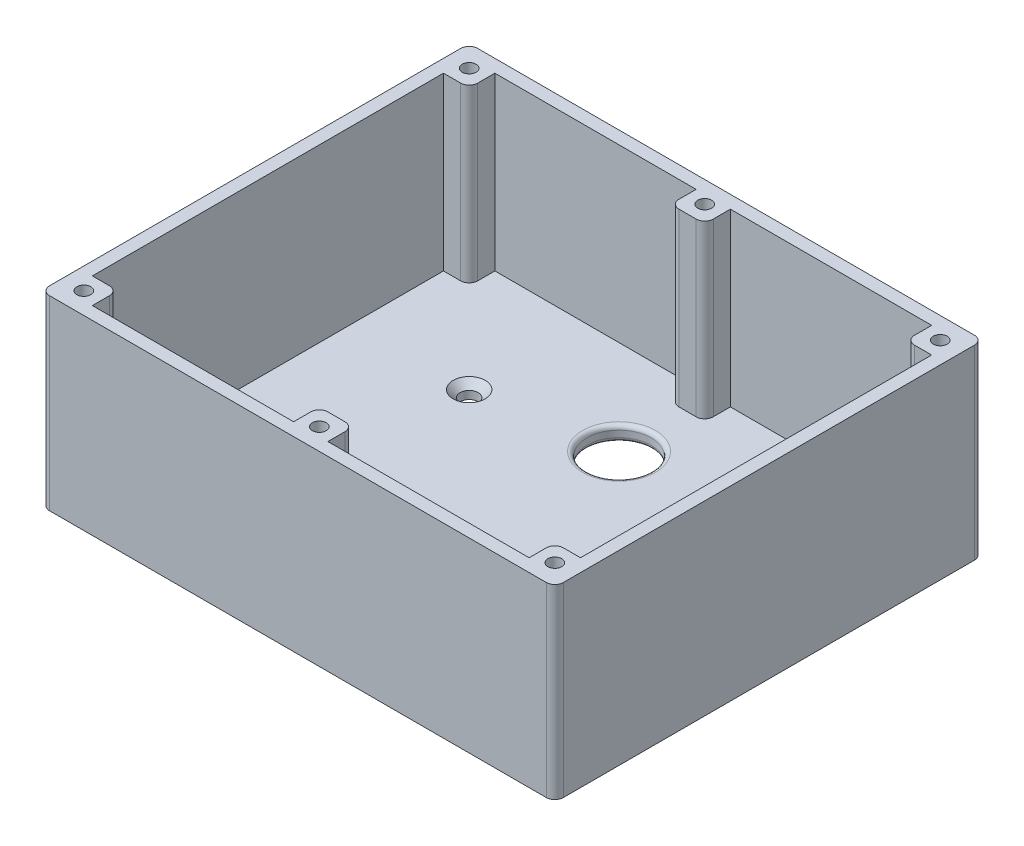
from build123d import *

# Parameters (mm, degrees)
SKETCH1_W                             = 120
SKETCH1_H                             = 100
BOTTOM_DEPTH                          = 3.5
SKETCH3_W                             = 120
SKETCH3_H                             = 100
WALL_DEPTH                            = 40
SKETCH4_R                             = 1.625
TOP_PLATE_SCREW_HOLES_DEPTH           = 30
TOP_PLATE_SCREW_HOLES_DRAFT           = -1
TOP_PLATE_SCREW_HOLES_PROFILE_2_DEPTH = 30
TOP_PLATE_SCREW_HOLES_PROFILE_2_DRAFT = -1
TOP_PLATE_SCREW_HOLES_PROFILE_3_DEPTH = 30
TOP_PLATE_SCREW_HOLES_PROFILE_3_DRAFT = -1
TOP_PLATE_SCREW_HOLES_PROFILE_4_DEPTH = 30
TOP_PLATE_SCREW_HOLES_PROFILE_4_DRAFT = -1
TOP_PLATE_SCREW_HOLES_PROFILE_5_DEPTH = 30
TOP_PLATE_SCREW_HOLES_PROFILE_5_DRAFT = -1
TOP_PLATE_SCREW_HOLES_PROFILE_6_DEPTH = 30
TOP_PLATE_SCREW_HOLES_PROFILE_6_DRAFT = -1
FILLET14_R                            = 2
FILLET13_R                            = 2
FILLET12_R                            = 2
FILLET11_R                            = 2
FILLET1_R                             = 2
FILLET2_R                             = 2
FILLET3_R                             = 2
FILLET4_R                             = 2
FILLET5_R                             = 2
FILLET6_R                             = 2
FILLET7_R                             = 2
FILLET8_R                             = 2
M4_MOUNT_R                            = 2.1
M4_MOUNT_CUT_DEPTH                    = 88.749643874
SKETCH7_R                             = 7.5
USB_CABEL_CUT_DEPTH                   = 90.399384785
FILLET9_R                             = 1
FILLET10_R                            = 1


with BuildPart() as part:
    # Sketch1 → Bottom (new body)
    with BuildSketch(Plane(origin=(0, 0, 0), x_dir=(1, 0, 0), z_dir=(0, 1, 0))):
        Rectangle(SKETCH1_W, SKETCH1_H)
    extrude(amount=BOTTOM_DEPTH)

    # Sketch3 → Wall (add)
    with BuildSketch(Plane(origin=(0, 3.5, 0), x_dir=(1, 0, 0), z_dir=(0, 1, 0))):
        Rectangle(SKETCH3_W, SKETCH3_H)
        Polygon((-51, 47), (-4, 47), (-4, 41), (4, 41), (4, 47), (51, 47), (51, 41), (57, 41), (57, -41), (51, -41), (51, -47), (4, -47), (4, -41), (-4, -41), (-4, -47), (-51, -47), (-51, -41), (-57, -41), (-57, 41), (-51, 41), align=None, mode=Mode.SUBTRACT)
    extrude(amount=WALL_DEPTH)


with BuildPart() as top_plate_screw_holes_tool:
    # Sketch4 → Top Plate Screw Holes (with draft: the straight prism first)
    with BuildSketch(Plane(origin=(0, 43.5, 0), x_dir=(1, 0, 0), z_dir=(0, 1, 0))):
        with Locations((-55, 45)):
            Circle(SKETCH4_R)
    extrude(amount=-TOP_PLATE_SCREW_HOLES_DEPTH)
    # Top Plate Screw Holes: the draft: its side faces are tilted about the plane it starts from
    top_plate_screw_holes_sides = [top_plate_screw_holes_tool.faces().sort_by_distance(p)[0] for p in [
        (-56.625, 28.5, -45),
    ]]
    draft(top_plate_screw_holes_sides, Plane(origin=(0, 43.5, 0), x_dir=(1, 0, 0), z_dir=(0, 1, 0)), TOP_PLATE_SCREW_HOLES_DRAFT)


with BuildPart() as part_1:
    add(part.part)

    # Top Plate Screw Holes: cut by top_plate_screw_holes_tool
    add(top_plate_screw_holes_tool.part, mode=Mode.SUBTRACT)


with BuildPart() as top_plate_screw_holes_profile_2_tool:
    # Sketch4 → Top Plate Screw Holes profile 2 (with draft: the straight prism first)
    with BuildSketch(Plane(origin=(0, 43.5, 0), x_dir=(1, 0, 0), z_dir=(0, 1, 0))):
        with Locations((55, 45)):
            Circle(SKETCH4_R)
    extrude(amount=-TOP_PLATE_SCREW_HOLES_PROFILE_2_DEPTH)
    # Top Plate Screw Holes profile 2: the draft: its side faces are tilted about the plane it starts from
    top_plate_screw_holes_profile_2_sides = [top_plate_screw_holes_profile_2_tool.faces().sort_by_distance(p)[0] for p in [
        (53.375, 28.5, -45),
    ]]
    draft(top_plate_screw_holes_profile_2_sides, Plane(origin=(0, 43.5, 0), x_dir=(1, 0, 0), z_dir=(0, 1, 0)), TOP_PLATE_SCREW_HOLES_PROFILE_2_DRAFT)


with BuildPart() as part_2:
    add(part_1.part)

    # Top Plate Screw Holes profile 2: cut by top_plate_screw_holes_profile_2_tool
    add(top_plate_screw_holes_profile_2_tool.part, mode=Mode.SUBTRACT)


with BuildPart() as top_plate_screw_holes_profile_3_tool:
    # Sketch4 → Top Plate Screw Holes profile 3 (with draft: the straight prism first)
    with BuildSketch(Plane(origin=(0, 43.5, 0), x_dir=(1, 0, 0), z_dir=(0, 1, 0))):
        with Locations((55, -45)):
            Circle(SKETCH4_R)
    extrude(amount=-TOP_PLATE_SCREW_HOLES_PROFILE_3_DEPTH)
    # Top Plate Screw Holes profile 3: the draft: its side faces are tilted about the plane it starts from
    top_plate_screw_holes_profile_3_sides = [top_plate_screw_holes_profile_3_tool.faces().sort_by_distance(p)[0] for p in [
        (53.375, 28.5, 45),
    ]]
    draft(top_plate_screw_holes_profile_3_sides, Plane(origin=(0, 43.5, 0), x_dir=(1, 0, 0), z_dir=(0, 1, 0)), TOP_PLATE_SCREW_HOLES_PROFILE_3_DRAFT)


with BuildPart() as part_3:
    add(part_2.part)

    # Top Plate Screw Holes profile 3: cut by top_plate_screw_holes_profile_3_tool
    add(top_plate_screw_holes_profile_3_tool.part, mode=Mode.SUBTRACT)


with BuildPart() as top_plate_screw_holes_profile_4_tool:
    # Sketch4 → Top Plate Screw Holes profile 4 (with draft: the straight prism first)
    with BuildSketch(Plane(origin=(0, 43.5, 0), x_dir=(1, 0, 0), z_dir=(0, 1, 0))):
        with Locations((-55, -45)):
            Circle(SKETCH4_R)
    extrude(amount=-TOP_PLATE_SCREW_HOLES_PROFILE_4_DEPTH)
    # Top Plate Screw Holes profile 4: the draft: its side faces are tilted about the plane it starts from
    top_plate_screw_holes_profile_4_sides = [top_plate_screw_holes_profile_4_tool.faces().sort_by_distance(p)[0] for p in [
        (-56.625, 28.5, 45),
    ]]
    draft(top_plate_screw_holes_profile_4_sides, Plane(origin=(0, 43.5, 0), x_dir=(1, 0, 0), z_dir=(0, 1, 0)), TOP_PLATE_SCREW_HOLES_PROFILE_4_DRAFT)


with BuildPart() as part_4:
    add(part_3.part)

    # Top Plate Screw Holes profile 4: cut by top_plate_screw_holes_profile_4_tool
    add(top_plate_screw_holes_profile_4_tool.part, mode=Mode.SUBTRACT)


with BuildPart() as top_plate_screw_holes_profile_5_tool:
    # Sketch4 → Top Plate Screw Holes profile 5 (with draft: the straight prism first)
    with BuildSketch(Plane(origin=(0, 43.5, 0), x_dir=(1, 0, 0), z_dir=(0, 1, 0))):
        with Locations((0, 45)):
            Circle(SKETCH4_R)
    extrude(amount=-TOP_PLATE_SCREW_HOLES_PROFILE_5_DEPTH)
    # Top Plate Screw Holes profile 5: the draft: its side faces are tilted about the plane it starts from
    top_plate_screw_holes_profile_5_sides = [top_plate_screw_holes_profile_5_tool.faces().sort_by_distance(p)[0] for p in [
        (-1.625, 28.5, -45),
    ]]
    draft(top_plate_screw_holes_profile_5_sides, Plane(origin=(0, 43.5, 0), x_dir=(1, 0, 0), z_dir=(0, 1, 0)), TOP_PLATE_SCREW_HOLES_PROFILE_5_DRAFT)


with BuildPart() as part_5:
    add(part_4.part)

    # Top Plate Screw Holes profile 5: cut by top_plate_screw_holes_profile_5_tool
    add(top_plate_screw_holes_profile_5_tool.part, mode=Mode.SUBTRACT)


with BuildPart() as top_plate_screw_holes_profile_6_tool:
    # Sketch4 → Top Plate Screw Holes profile 6 (with draft: the straight prism first)
    with BuildSketch(Plane(origin=(0, 43.5, 0), x_dir=(1, 0, 0), z_dir=(0, 1, 0))):
        with Locations((0, -45)):
            Circle(SKETCH4_R)
    extrude(amount=-TOP_PLATE_SCREW_HOLES_PROFILE_6_DEPTH)
    # Top Plate Screw Holes profile 6: the draft: its side faces are tilted about the plane it starts from
    top_plate_screw_holes_profile_6_sides = [top_plate_screw_holes_profile_6_tool.faces().sort_by_distance(p)[0] for p in [
        (-1.625, 28.5, 45),
    ]]
    draft(top_plate_screw_holes_profile_6_sides, Plane(origin=(0, 43.5, 0), x_dir=(1, 0, 0), z_dir=(0, 1, 0)), TOP_PLATE_SCREW_HOLES_PROFILE_6_DRAFT)


with BuildPart() as part_6:
    add(part_5.part)

    # Top Plate Screw Holes profile 6: cut by top_plate_screw_holes_profile_6_tool
    add(top_plate_screw_holes_profile_6_tool.part, mode=Mode.SUBTRACT)

    # Fillet14
    fillet14_edges = [part_6.edges().sort_by_distance(p)[0] for p in [
        (-4, 23.5, 41),
    ]]
    fillet(fillet14_edges, radius=FILLET14_R)

    # Fillet13
    fillet13_edges = [part_6.edges().sort_by_distance(p)[0] for p in [
        (4, 23.5, 41),
    ]]
    fillet(fillet13_edges, radius=FILLET13_R)

    # Fillet12
    fillet12_edges = [part_6.edges().sort_by_distance(p)[0] for p in [
        (-4, 23.5, -41),
    ]]
    fillet(fillet12_edges, radius=FILLET12_R)

    # Fillet11
    fillet11_edges = [part_6.edges().sort_by_distance(p)[0] for p in [
        (4, 23.5, -41),
    ]]
    fillet(fillet11_edges, radius=FILLET11_R)

    # Fillet1
    fillet1_edges = [part_6.edges().sort_by_distance(p)[0] for p in [
        (-51, 23.5, 41),
    ]]
    fillet(fillet1_edges, radius=FILLET1_R)

    # Fillet2
    fillet2_edges = [part_6.edges().sort_by_distance(p)[0] for p in [
        (51, 23.5, 41),
    ]]
    fillet(fillet2_edges, radius=FILLET2_R)

    # Fillet3
    fillet3_edges = [part_6.edges().sort_by_distance(p)[0] for p in [
        (51, 23.5, -41),
    ]]
    fillet(fillet3_edges, radius=FILLET3_R)

    # Fillet4
    fillet4_edges = [part_6.edges().sort_by_distance(p)[0] for p in [
        (-51, 23.5, -41),
    ]]
    fillet(fillet4_edges, radius=FILLET4_R)

    # Fillet5
    fillet5_edges = [part_6.edges().sort_by_distance(p)[0] for p in [
        (-60, 21.75, -50),
    ]]
    fillet(fillet5_edges, radius=FILLET5_R)

    # Fillet6
    fillet6_edges = [part_6.edges().sort_by_distance(p)[0] for p in [
        (60, 21.75, -50),
    ]]
    fillet(fillet6_edges, radius=FILLET6_R)

    # Fillet7
    fillet7_edges = [part_6.edges().sort_by_distance(p)[0] for p in [
        (60, 21.75, 50),
    ]]
    fillet(fillet7_edges, radius=FILLET7_R)

    # Fillet8
    fillet8_edges = [part_6.edges().sort_by_distance(p)[0] for p in [
        (-60, 21.75, 50),
    ]]
    fillet(fillet8_edges, radius=FILLET8_R)

    # M4 Mount → M4 Mount Cut (cut, through all)
    with BuildSketch(Plane.XZ.offset(-3.5)):
        with Locations(Location((30, -20, 0), (0, 0, 270))):
            Circle(M4_MOUNT_R)
        with Locations(Location((30, 20, 0), (0, 0, 270))):
            Circle(M4_MOUNT_R)
        with Locations(Location((-30, 20, 0), (0, 0, 90))):
            Circle(M4_MOUNT_R)
        with Locations(Location((-30, -20, 0), (0, 0, 90))):
            Circle(M4_MOUNT_R)
    extrude(amount=M4_MOUNT_CUT_DEPTH, mode=Mode.SUBTRACT)

    # Cut-Extrude3 cone 1 section (through the dimple's axis) → Cut-Extrude3 (revolve, cut)
    with BuildSketch(Plane(origin=(30, 3.5, 20), x_dir=(0, 0, 1), z_dir=(1, 0, 0))):
        Polygon((0, 0), (3.75, 0), (0, 3.75), align=None)
    revolve(axis=Axis((30, 3.5, 20), (0, -1, 0)), mode=Mode.SUBTRACT)

    # Cut-Extrude3 cone 2 section (through the dimple's axis) → Cut-Extrude3 cone 2 (revolve, cut)
    with BuildSketch(Plane(origin=(30, 3.5, -20), x_dir=(0, 0, 1), z_dir=(1, 0, 0))):
        Polygon((0, 0), (3.75, 0), (0, 3.75), align=None)
    revolve(axis=Axis((30, 3.5, -20), (0, -1, 0)), mode=Mode.SUBTRACT)

    # Cut-Extrude3 cone 3 section (through the dimple's axis) → Cut-Extrude3 cone 3 (revolve, cut)
    with BuildSketch(Plane(origin=(-30, 3.5, -20), x_dir=(0, 0, 1), z_dir=(1, 0, 0))):
        Polygon((0, 0), (3.75, 0), (0, 3.75), align=None)
    revolve(axis=Axis((-30, 3.5, -20), (0, -1, 0)), mode=Mode.SUBTRACT)

    # Cut-Extrude3 cone 4 section (through the dimple's axis) → Cut-Extrude3 cone 4 (revolve, cut)
    with BuildSketch(Plane(origin=(-30, 3.5, 20), x_dir=(0, 0, 1), z_dir=(1, 0, 0))):
        Polygon((0, 0), (3.75, 0), (0, 3.75), align=None)
    revolve(axis=Axis((-30, 3.5, 20), (0, -1, 0)), mode=Mode.SUBTRACT)

    # Sketch7 → USB Cabel Cut (cut, through all)
    with BuildSketch(Plane.XZ):
        with Locations(Location((0, -25, 0), (0, 0, 270))):
            Circle(SKETCH7_R)
    extrude(amount=-USB_CABEL_CUT_DEPTH, mode=Mode.SUBTRACT)

    # Fillet9
    fillet9_edges = [part_6.edges().sort_by_distance(p)[0] for p in [
        (0, 0, -17.5),
    ]]
    fillet(fillet9_edges, radius=FILLET9_R)

    # Fillet10
    fillet10_edges = [part_6.edges().sort_by_distance(p)[0] for p in [
        (0, 3.5, -17.5),
    ]]
    fillet(fillet10_edges, radius=FILLET10_R)


solid = part_6.part
